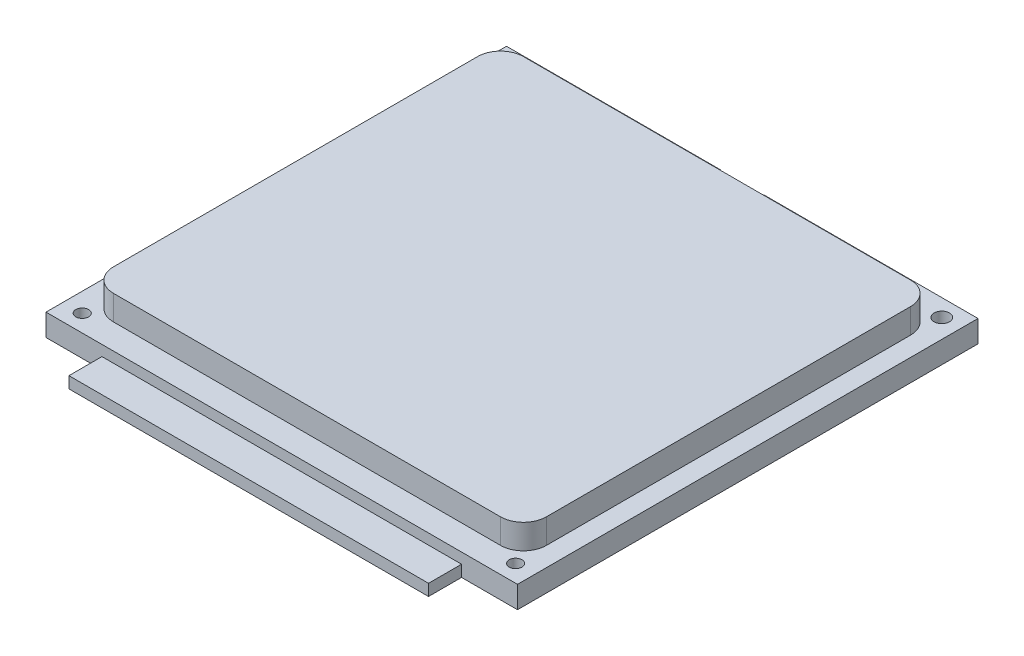
from build123d import *

# Parameters (mm, degrees)
SKETCH1_W           = 65.278
SKETCH1_H           = 63.754
BOSS_EXTRUDE1_DEPTH = 3.048
SKETCH2_W           = 59.944
SKETCH2_H           = 56.769
BOSS_EXTRUDE2_DEPTH = 3.429
SKETCH3_R           = 1.0668
SKETCH3_R_2         = 0.889
CUT_EXTRUDE1_DEPTH  = 46.751562716
FILLET1_R           = 3.175
SKETCH4_W           = 5.969
SKETCH4_H           = 3.4925
CUT_EXTRUDE2_DEPTH  = 46.751562716
SKETCH5_W           = 49.784
SKETCH5_H           = 4.572
BOSS_EXTRUDE3_DEPTH = 1.5875


with BuildPart() as part:
    # Sketch1 → Boss-Extrude1 (new body)
    with BuildSketch(Plane(origin=(0, 0, 0), x_dir=(1, 0, 0), z_dir=(0, 1, 0))):
        Rectangle(SKETCH1_W, SKETCH1_H)
    extrude(amount=BOSS_EXTRUDE1_DEPTH)

    # Sketch2 → Boss-Extrude2 (add)
    with BuildSketch(Plane(origin=(0, 3.048, 0), x_dir=(1, 0, 0), z_dir=(0, 1, 0))):
        Rectangle(SKETCH2_W, SKETCH2_H)
    extrude(amount=BOSS_EXTRUDE2_DEPTH)

    # Sketch3 → Cut-Extrude1 (cut, through all)
    with BuildSketch(Plane(origin=(0, 3.048, 0), x_dir=(1, 0, 0), z_dir=(0, 1, 0))):
        with Locations(Location((-30, 29.5, 0), (0, 0, 270))):
            Circle(SKETCH3_R)
        with Locations(Location((30, 29.5, 0), (0, 0, 270))):
            Circle(SKETCH3_R)
        with Locations(Location((30, -29.5, 0), (0, 0, 270))):
            Circle(SKETCH3_R_2)
        with Locations(Location((-30, -29.5, 0), (0, 0, 270))):
            Circle(SKETCH3_R_2)
    extrude(amount=-CUT_EXTRUDE1_DEPTH, mode=Mode.SUBTRACT)

    # Fillet1
    fillet1_edges = [part.edges().sort_by_distance(p)[0] for p in [
        (29.972, 4.7625, 28.3845),
        (29.972, 4.7625, -28.3845),
        (-29.972, 4.7625, -28.3845),
        (-29.972, 4.7625, 28.3845),
    ]]
    fillet(fillet1_edges, radius=FILLET1_R)

    # Sketch4 → Cut-Extrude2 (cut, through all)
    with BuildSketch(Plane(origin=(0, 3.048, 0), x_dir=(1, 0, 0), z_dir=(0, 1, 0))):
        with Locations((0, 30.13075)):
            Rectangle(SKETCH4_W, SKETCH4_H)
    extrude(amount=-CUT_EXTRUDE2_DEPTH, mode=Mode.SUBTRACT)

    # Sketch5 → Boss-Extrude3 (add)
    with BuildSketch(Plane.XZ):
        with Locations((0, 34.163)):
            Rectangle(SKETCH5_W, SKETCH5_H)
    extrude(amount=-BOSS_EXTRUDE3_DEPTH)


solid = part.part
